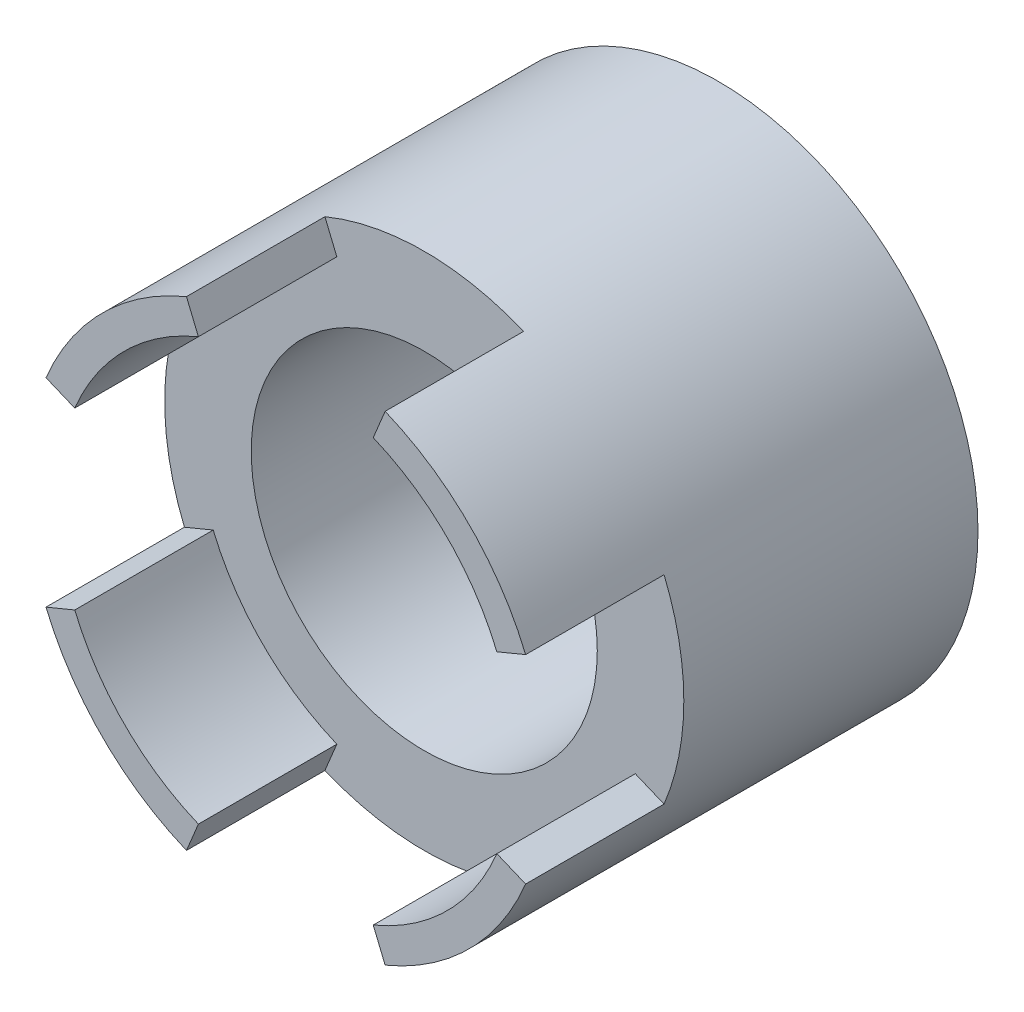
from build123d import *

# Parameters (mm, degrees)
SKETCH1_R           = 19.05
SKETCH1_R_2         = 16.764
BOSS_EXTRUDE1_DEPTH = 31.75
BOSS_EXTRUDE2_START = -10.16
SKETCH2_R           = 16.764
SKETCH2_R_2         = 12.7
BOSS_EXTRUDE2_DEPTH = 20.32
CUT_EXTRUDE1_DEPTH  = 10.16


with BuildPart() as part:
    # Sketch1 → Boss-Extrude1 (new body)
    with BuildSketch(Plane.XY):
        Circle(SKETCH1_R)
        Circle(SKETCH1_R_2, mode=Mode.SUBTRACT)
    extrude(amount=-BOSS_EXTRUDE1_DEPTH)

    # Sketch2 → Boss-Extrude2 (add)
    with BuildSketch(Plane.XY.offset(BOSS_EXTRUDE2_START)):
        Circle(SKETCH2_R)
        Circle(SKETCH2_R_2, mode=Mode.SUBTRACT)
    extrude(amount=-BOSS_EXTRUDE2_DEPTH)

    # Sketch4 → Cut-Extrude1 (cut)
    with BuildSketch(Plane.XY):
        with BuildLine():
            Line((-7.290119387, 17.599905094), (-6.41530506, 15.487916483))
            ThreePointArc((-6.41530506, 15.487916483), (0, 16.764), (6.41530506, 15.487916483))
            Line((6.41530506, 15.487916483), (7.290119387, 17.599905094))
            ThreePointArc((7.290119387, 17.599905094), (0, 19.05), (-7.290119387, 17.599905094))
        make_face()
        with BuildLine():
            Line((17.599905094, -7.290119387), (15.487916483, -6.41530506))
            ThreePointArc((15.487916483, -6.41530506), (16.764, 0), (15.487916483, 6.41530506))
            Line((15.487916483, 6.41530506), (17.599905094, 7.290119387))
            ThreePointArc((17.599905094, 7.290119387), (19.05, 0), (17.599905094, -7.290119387))
        make_face()
        with BuildLine():
            Line((-7.290119387, -17.599905094), (-6.41530506, -15.487916483))
            ThreePointArc((-6.41530506, -15.487916483), (0, -16.764), (6.41530506, -15.487916483))
            Line((6.41530506, -15.487916483), (7.290119387, -17.599905094))
            ThreePointArc((7.290119387, -17.599905094), (0, -19.05), (-7.290119387, -17.599905094))
        make_face()
        with BuildLine():
            Line((-17.599905094, 7.290119387), (-15.487916483, 6.41530506))
            ThreePointArc((-15.487916483, 6.41530506), (-16.764, 0), (-15.487916483, -6.41530506))
            Line((-15.487916483, -6.41530506), (-17.599905094, -7.290119387))
            ThreePointArc((-17.599905094, -7.290119387), (-19.05, 0), (-17.599905094, 7.290119387))
        make_face()
    extrude(amount=-CUT_EXTRUDE1_DEPTH, mode=Mode.SUBTRACT)


solid = part.part
